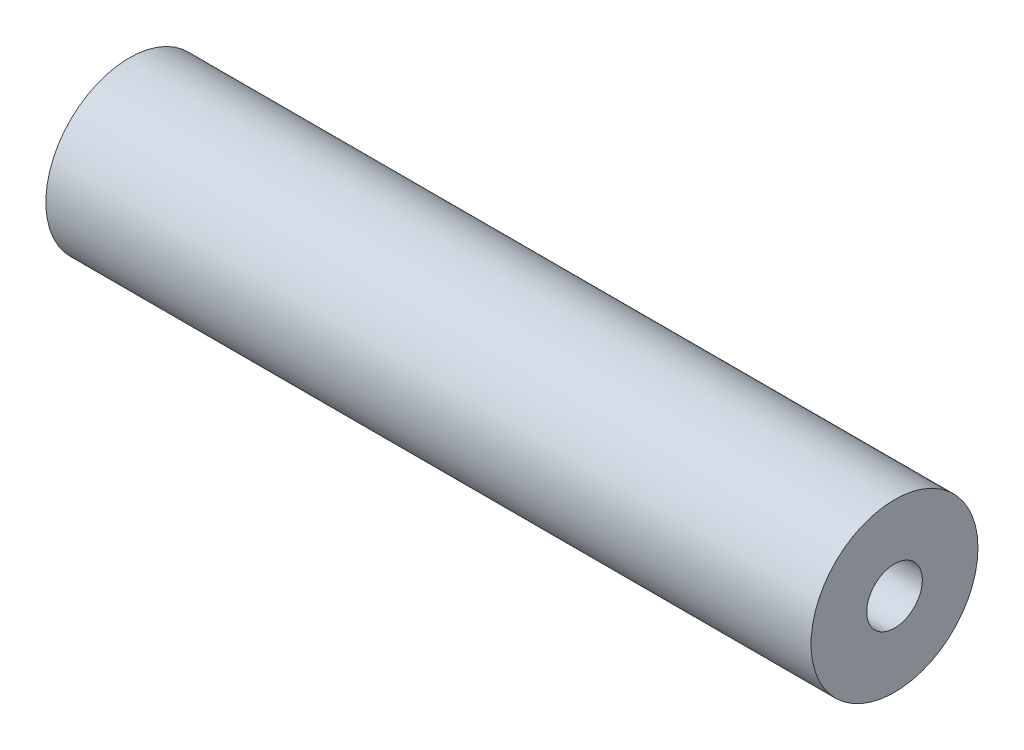
from build123d import *

# Parameters (mm, degrees)
SKETCH1_R           = 12
BOSS_EXTRUDE1_DEPTH = 110
SKETCH2_R           = 4
CUT_EXTRUDE1_DEPTH  = 222


with BuildPart() as part:
    # Sketch1 → Boss-Extrude1 (new body)
    with BuildSketch(Plane(origin=(0, 0, 0), x_dir=(0, 0, -1), z_dir=(1, 0, 0))):
        Circle(SKETCH1_R)
    extrude(amount=BOSS_EXTRUDE1_DEPTH)

    # Sketch2 → Cut-Extrude1 (cut)
    with BuildSketch(Plane(origin=(110, 0, 0), x_dir=(0, 0, -1), z_dir=(1, 0, 0))):
        Circle(SKETCH2_R)
    extrude(amount=-CUT_EXTRUDE1_DEPTH, mode=Mode.SUBTRACT)


solid = part.part
